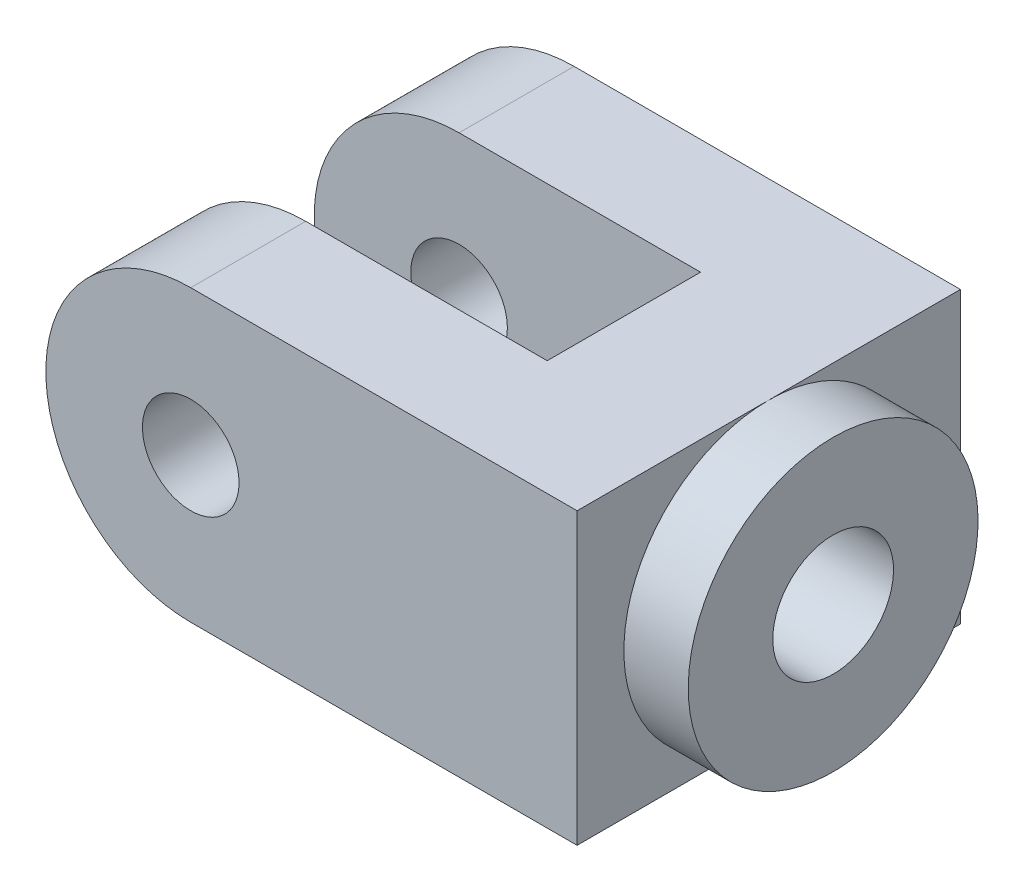
from build123d import *

# Parameters (mm, degrees)
SKETCH1_W               = 132
SKETCH1_H               = 72
BOSS_EXTRUDE1_DEPTH     = 47.625
CUT_EXTRUDE1_DEPTH      = 122.344808294
CUT_EXTRUDE1_DEPTH_BACK = 122.344808294
SKETCH3_W               = 96
SKETCH3_H               = 38.1
CUT_EXTRUDE2_DEPTH      = 85.25
SKETCH4_R               = 15
CUT_EXTRUDE3_DEPTH      = 85.25
BOSS_EXTRUDE2_START     = 16
SKETCH5_R               = 36
SKETCH5_R_2             = 15
BOSS_EXTRUDE2_DEPTH     = 16
CUT_EXTRUDE4_DEPTH      = 131.738527221
CUT_EXTRUDE4_DEPTH_BACK = 131.738527221
SKETCH6_R               = 12
SCALE1_SCALE            = 0.53
SCALE2_SCALE            = 0.66


with BuildPart() as part:
    # Sketch1 → Boss-Extrude1 (new, symmetric)
    with BuildSketch(Plane.XY):
        Rectangle(SKETCH1_W, SKETCH1_H)
    extrude(amount=BOSS_EXTRUDE1_DEPTH, both=True)

    # Sketch2 → Cut-Extrude1 (cut, two sides: drawn at the far end of the back side and taken through both)
    with BuildSketch(Plane.XY.offset(47.625).offset(-CUT_EXTRUDE1_DEPTH_BACK)):
        with BuildLine():
            Line((220.000003209, 36), (-30, 36))
            ThreePointArc((-30, 36), (-66, 1.003e-06), (-30.000002006, -36))
            Line((-30.000002006, -36), (220.000001203, -36.000013927))
            Line((220.000001203, -36.000013927), (-280.000005214, -36))
            Line((-280.000005214, -36), (-280.000003209, 36.000013927))
            Line((-280.000003209, 36.000013927), (220.000003209, 36))
        make_face()
    extrude(amount=CUT_EXTRUDE1_DEPTH + CUT_EXTRUDE1_DEPTH_BACK, mode=Mode.SUBTRACT)

    # Sketch3 → Cut-Extrude2 (cut)
    with BuildSketch(Plane(origin=(0, 36, 0), x_dir=(1, 0, 0), z_dir=(0, 1, 0))):
        with Locations((-18, 0)):
            Rectangle(SKETCH3_W, SKETCH3_H)
    extrude(amount=-CUT_EXTRUDE2_DEPTH, mode=Mode.SUBTRACT)

    # Sketch4 → Cut-Extrude3 (cut)
    with BuildSketch(Plane(origin=(66, 0, 0), x_dir=(0, 0, -1), z_dir=(1, 0, 0))):
        with Locations(Location((0, 0, 0), (0, 0, 90))):
            Circle(SKETCH4_R)
    extrude(amount=-CUT_EXTRUDE3_DEPTH, mode=Mode.SUBTRACT)

    # Sketch5 → Boss-Extrude2 (add)
    with BuildSketch(Plane(origin=(66, 0, 0), x_dir=(0, 0, -1), z_dir=(1, 0, 0)).offset(BOSS_EXTRUDE2_START)):
        with Locations(Location((0, 0, 0), (0, 0, 90))):
            Circle(SKETCH5_R)
        with Locations(Location((0, 0, 0), (0, 0, 90))):
            Circle(SKETCH5_R_2, mode=Mode.SUBTRACT)
    extrude(amount=-BOSS_EXTRUDE2_DEPTH)

    # Sketch6 → Cut-Extrude4 (cut, two sides: drawn at the far end of the back side and taken through both)
    with BuildSketch(Plane.XY.offset(47.625).offset(-CUT_EXTRUDE4_DEPTH_BACK)):
        with Locations((-30, 0)):
            Circle(SKETCH6_R)
    extrude(amount=CUT_EXTRUDE4_DEPTH + CUT_EXTRUDE4_DEPTH_BACK, mode=Mode.SUBTRACT)


with BuildPart() as part_1:
    # Scale1: scaled about (16.519385086, 0, 0)
    add(part.part.scale(SCALE1_SCALE).moved(Location((7.76411099, 0, 0))))


with BuildPart() as part_2:
    # Scale2: scaled about (16.519385086, 0, 0)
    add(part_1.part.scale(SCALE2_SCALE).moved(Location((5.616590929, 0, 0))))


solid = part_2.part
